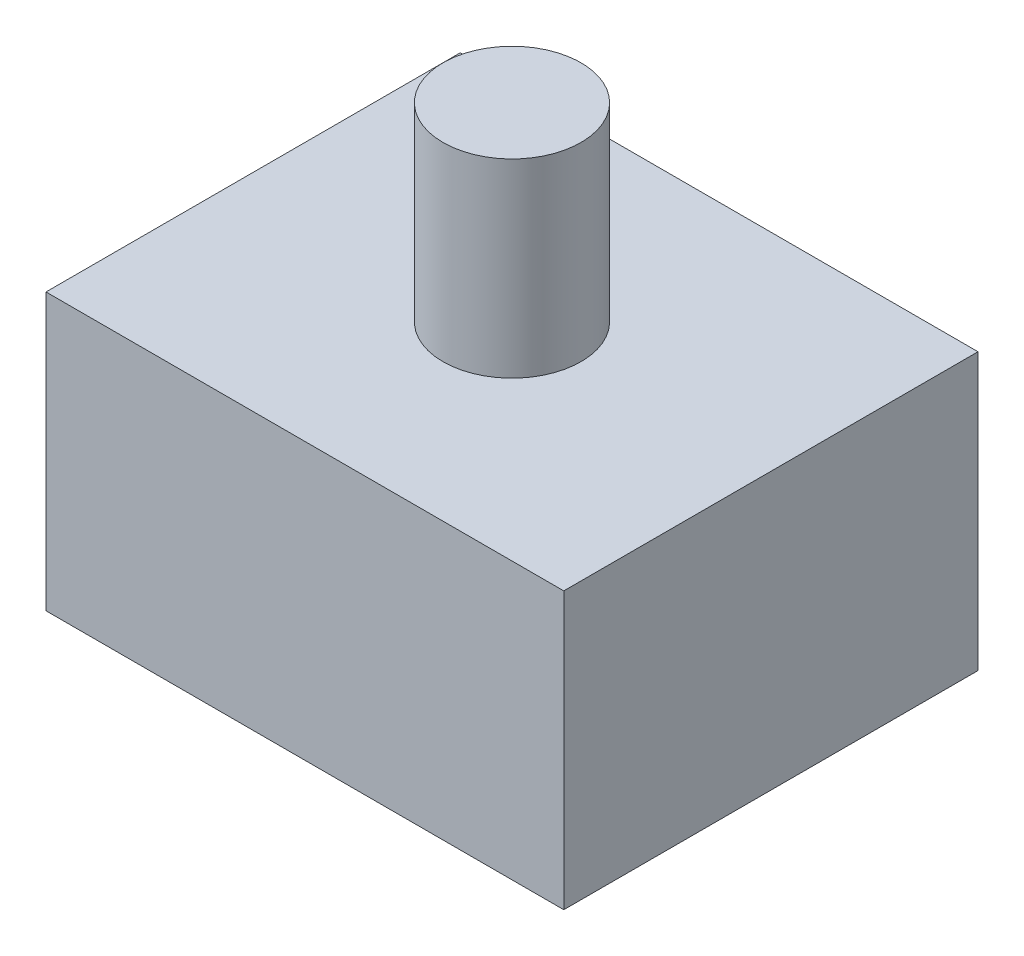
from build123d import *

# Parameters (mm, degrees)
SKETCH_1_W      = 30
SKETCH_1_H      = 24
EXTRUDE_1_DEPTH = 16
SKETCH_2_R      = 4
EXTRUDE_2_DEPTH = 11


with BuildPart() as part:
    # 草图1 → 凸台-拉伸1 (new body)
    with BuildSketch(Plane(origin=(0, 0, 0), x_dir=(1, 0, 0), z_dir=(0, 1, 0))):
        Rectangle(SKETCH_1_W, SKETCH_1_H)
    extrude(amount=EXTRUDE_1_DEPTH)

    # 草图2 → 凸台-拉伸2 (add)
    with BuildSketch(Plane(origin=(0, 16, 0), x_dir=(1, 0, 0), z_dir=(0, 1, 0))):
        with Locations(Location((0, 0, 0), (0, 0, 270))):
            Circle(SKETCH_2_R)
    extrude(amount=EXTRUDE_2_DEPTH)


solid = part.part
